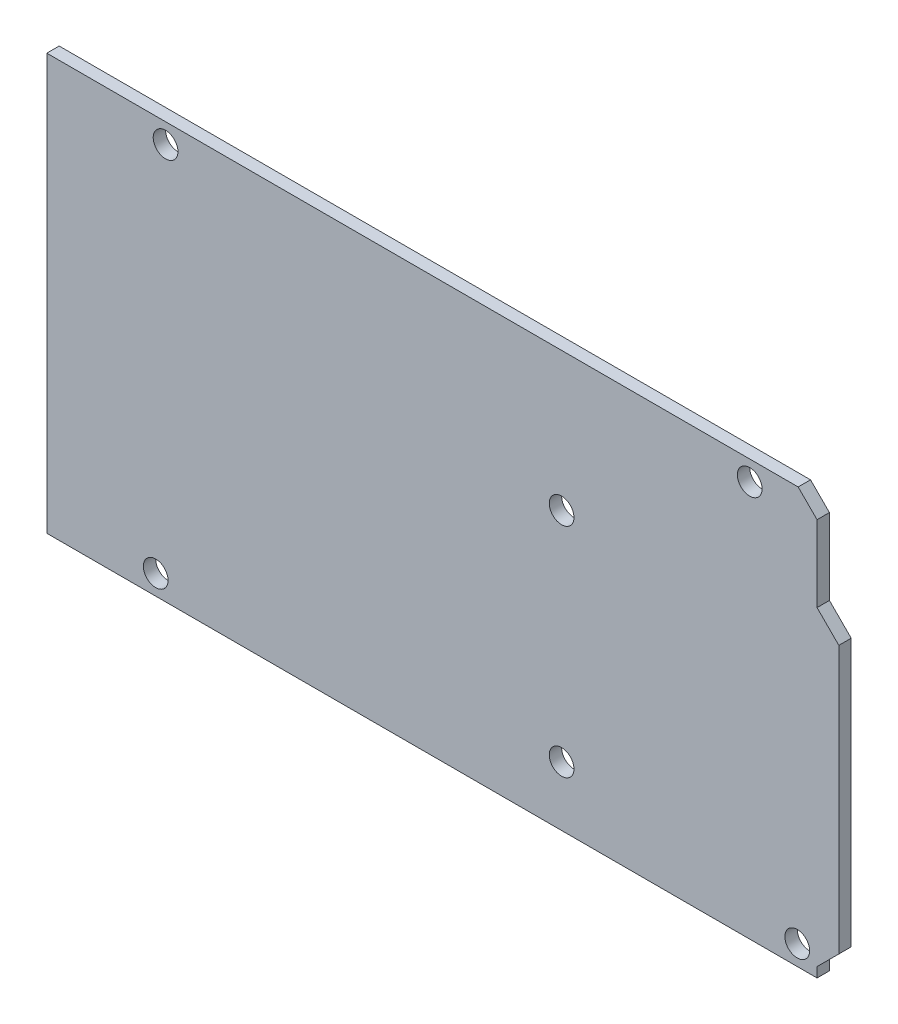
from build123d import *

# Parameters (mm, degrees)
SKETCH1_R           = 1.5875
BOSS_EXTRUDE1_DEPTH = 1.5875


with BuildPart() as part:
    # Sketch1 → Boss-Extrude1 (new body)
    with BuildSketch(Plane.XY):
        Polygon((0, 53.34), (0, 0), (98.806, 0), (98.806, 1.27), (101.6, 4.064), (101.6, 38.354), (98.806, 41.148), (98.806, 50.915330847), (96.381330847, 53.34), align=None)
        with Locations((13.97, 2.54)):
            Circle(SKETCH1_R, mode=Mode.SUBTRACT)
        with Locations((66.04, 7.62)):
            Circle(SKETCH1_R, mode=Mode.SUBTRACT)
        with Locations((96.266, 2.54)):
            Circle(SKETCH1_R, mode=Mode.SUBTRACT)
        with Locations((15.24, 50.8)):
            Circle(SKETCH1_R, mode=Mode.SUBTRACT)
        with Locations((66.04, 35.56)):
            Circle(SKETCH1_R, mode=Mode.SUBTRACT)
        with Locations((90.17, 50.8)):
            Circle(SKETCH1_R, mode=Mode.SUBTRACT)
    extrude(amount=BOSS_EXTRUDE1_DEPTH)


solid = part.part
